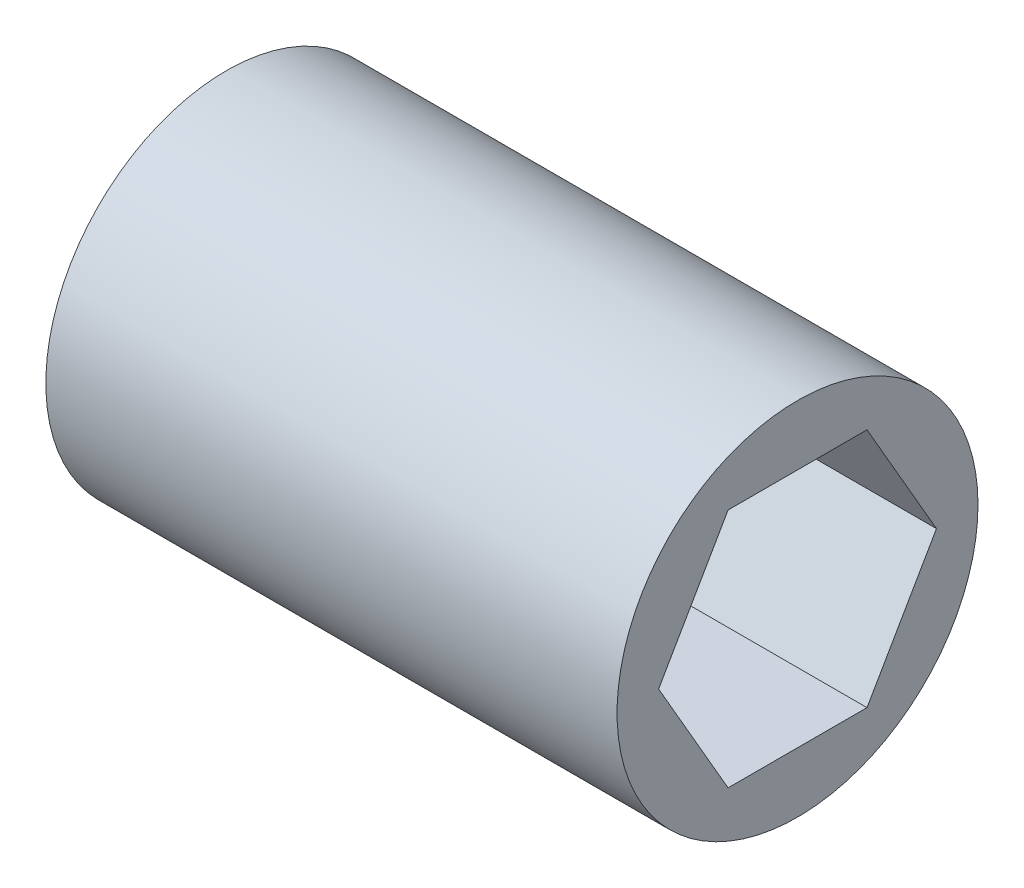
from build123d import *

# Parameters (mm, degrees)
SKETCH1_R           = 9.525
BOSS_EXTRUDE1_DEPTH = 15.075


with BuildPart() as part:
    # Sketch1 → Boss-Extrude1 (new, symmetric)
    with BuildSketch(Plane(origin=(0, 0, 0), x_dir=(0, 0, -1), z_dir=(1, 0, 0))):
        Circle(SKETCH1_R)
        Polygon((7.332348419, 0), (3.666174209, 6.35), (-3.666174209, 6.35), (-7.332348419, 0), (-3.666174209, -6.35), (3.666174209, -6.35), align=None, mode=Mode.SUBTRACT)
    extrude(amount=BOSS_EXTRUDE1_DEPTH, both=True)


solid = part.part
